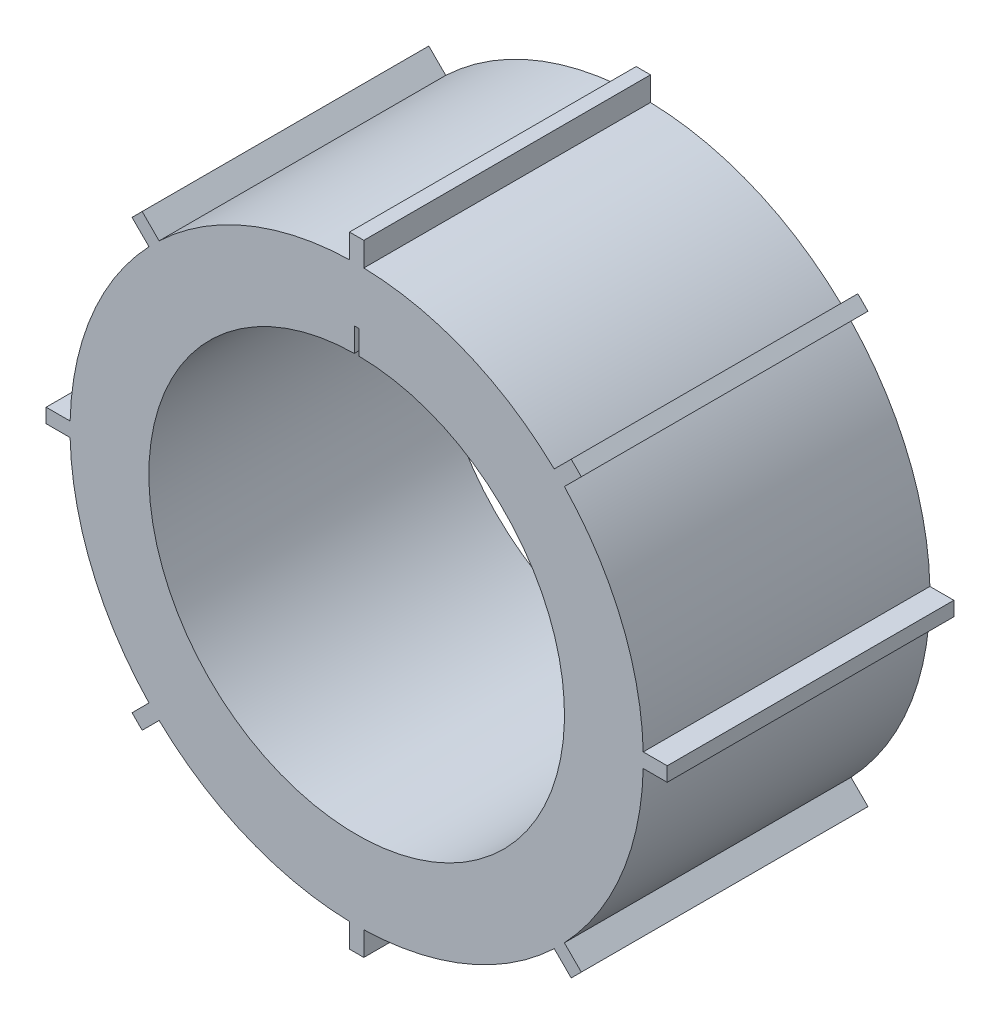
from build123d import *

# Parameters (mm, degrees)
SKETCH1_R           = 60
SKETCH1_R_2         = 43.5
EXTRUSION1_DEPTH    = 60
EXTRUSION3_START    = -60
EXTRUSION3_DEPTH    = 60
BOSS_EXTRUDE1_DEPTH = 60


with BuildPart() as part:
    # Sketch1 → Extrusion1 (new body)
    with BuildSketch(Plane.XY):
        Circle(SKETCH1_R)
        Circle(SKETCH1_R_2, mode=Mode.SUBTRACT)
    extrude(amount=EXTRUSION1_DEPTH)

    # Sketch3 → Extrusion3 (cut)
    with BuildSketch(Plane.XY.offset(60).offset(EXTRUSION3_START)):
        with BuildLine():
            Line((-0.5, 48.5), (-0.5, 43.497126342))
            ThreePointArc((-0.5, 43.497126342), (0, 43.5), (0.5, 43.497126342))
            Line((0.5, 43.497126342), (0.5, 48.5))
            Line((0.5, 48.5), (-0.5, 48.5))
        make_face()
    extrude(amount=EXTRUSION3_DEPTH, mode=Mode.SUBTRACT)

    # Sketch4 → Boss-Extrude1 (add, through all)
    with BuildSketch(Plane.XY.offset(60)):
        with BuildLine():
            Line((41.352486375, 43.473806719), (44.901280605, 47.022600949))
            Line((44.901280605, 47.022600949), (47.022600949, 44.901280605))
            Line((47.022600949, 44.901280605), (43.473806719, 41.352486375))
            ThreePointArc((43.473806719, 41.352486375), (42.426406871, 42.426406871), (41.352486375, 43.473806719))
        make_face()
        with BuildLine():
            Line((1.5, 59.981247069), (1.5, 65))
            Line((1.5, 65), (-1.5, 65))
            Line((-1.5, 65), (-1.5, 59.981247069))
            ThreePointArc((-1.5, 59.981247069), (0, 60), (1.5, 59.981247069))
        make_face()
        with BuildLine():
            Line((59.981247069, 1.5), (65, 1.5))
            Line((65, 1.5), (65, -1.5))
            Line((65, -1.5), (59.981247069, -1.5))
            ThreePointArc((59.981247069, -1.5), (60, 0), (59.981247069, 1.5))
        make_face()
        with BuildLine():
            Line((43.473806719, -41.352486375), (47.022600949, -44.901280605))
            Line((47.022600949, -44.901280605), (44.901280605, -47.022600949))
            Line((44.901280605, -47.022600949), (41.352486375, -43.473806719))
            ThreePointArc((41.352486375, -43.473806719), (42.426406871, -42.426406871), (43.473806719, -41.352486375))
        make_face()
        with BuildLine():
            Line((1.5, -59.981247069), (1.5, -65))
            Line((1.5, -65), (-1.5, -65))
            Line((-1.5, -65), (-1.5, -59.981247069))
            ThreePointArc((-1.5, -59.981247069), (0, -60), (1.5, -59.981247069))
        make_face()
        with BuildLine():
            Line((-41.352486375, -43.473806719), (-44.901280605, -47.022600949))
            Line((-44.901280605, -47.022600949), (-47.022600949, -44.901280605))
            Line((-47.022600949, -44.901280605), (-43.473806719, -41.352486375))
            ThreePointArc((-43.473806719, -41.352486375), (-42.426406871, -42.426406871), (-41.352486375, -43.473806719))
        make_face()
        with BuildLine():
            Line((-59.981247069, -1.5), (-65, -1.5))
            Line((-65, -1.5), (-65, 1.5))
            Line((-65, 1.5), (-59.981247069, 1.5))
            ThreePointArc((-59.981247069, 1.5), (-60, 0), (-59.981247069, -1.5))
        make_face()
        with BuildLine():
            Line((-43.473806719, 41.352486375), (-47.022600949, 44.901280605))
            Line((-47.022600949, 44.901280605), (-44.901280605, 47.022600949))
            Line((-44.901280605, 47.022600949), (-41.352486375, 43.473806719))
            ThreePointArc((-41.352486375, 43.473806719), (-42.426406871, 42.426406871), (-43.473806719, 41.352486375))
        make_face()
    extrude(amount=-BOSS_EXTRUDE1_DEPTH)


solid = part.part
